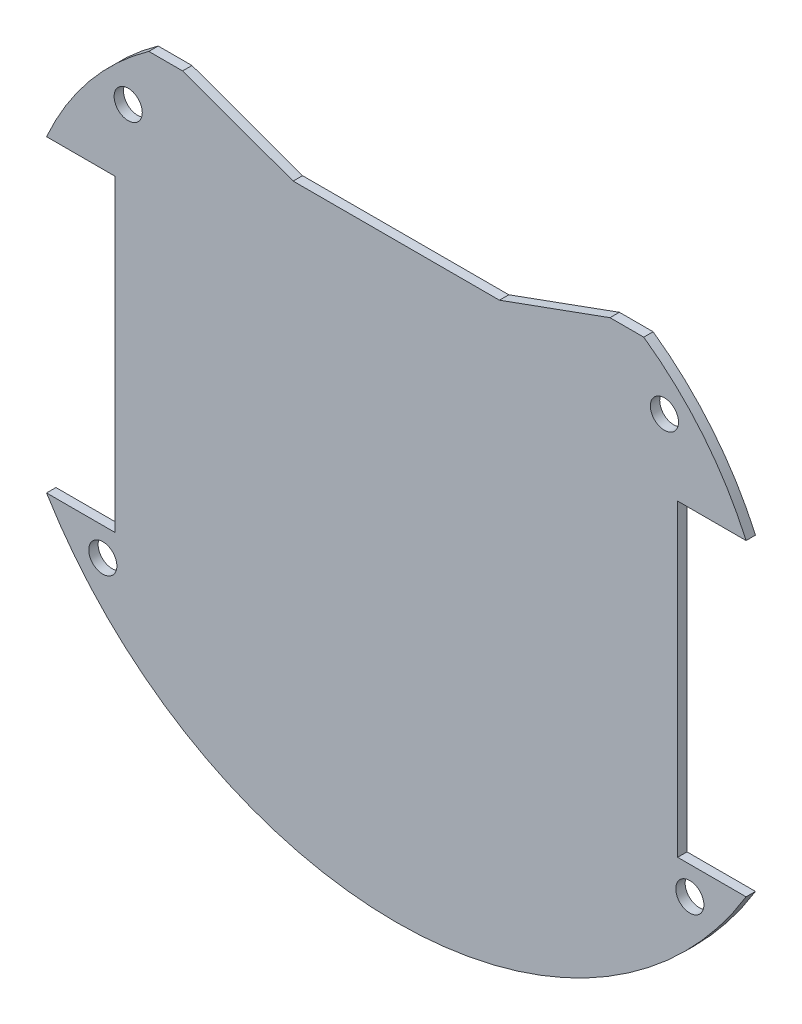
from build123d import *

# Parameters (mm, degrees)
BOSS_EXTRUDE1_DEPTH = 3
SKETCH2_R           = 1.5
CUT_EXTRUDE3_DEPTH  = 3
CUT_EXTRUDE4_START  = -10
CUT_EXTRUDE4_DEPTH  = 10
BOSS_EXTRUDE2_START = -3
BOSS_EXTRUDE2_DEPTH = 3
SKETCH5_W           = 0.56
SKETCH5_H           = 32.898596714
CUT_EXTRUDE5_DEPTH  = 3
SKETCH6_W           = 0.2
SKETCH6_H           = 32.898596714
CUT_EXTRUDE6_DEPTH  = 3
SKETCH7_R           = 2
CUT_EXTRUDE8_DEPTH  = 3
BOSS_EXTRUDE3_START = -3
BOSS_EXTRUDE3_DEPTH = 3
CUT_EXTRUDE9_START  = -3
CUT_EXTRUDE9_DEPTH  = 3
BOSS_EXTRUDE5_START = -3
BOSS_EXTRUDE5_DEPTH = 3
SKETCH11_R          = 1.5
CUT_EXTRUDE10_DEPTH = 3
CUT_EXTRUDE11_DEPTH = 3
SKETCH13_W          = 7
SKETCH13_H          = 1.5
CUT_EXTRUDE12_DEPTH = 3
SKETCH14_R          = 2
SKETCH14_R_2        = 1.5
SKETCH14_W          = 7
SKETCH14_H          = 1.5
BOSS_EXTRUDE6_DEPTH = 3
CUT_EXTRUDE13_START = -2
CUT_EXTRUDE13_DEPTH = 2
SKETCH16_R          = 1.5
CUT_EXTRUDE14_DEPTH = 2


with BuildPart() as part:
    # Sketch1 → Boss-Extrude1 (new body)
    with BuildSketch(Plane.XY):
        with BuildLine():
            Line((-11, 25.5), (-22.790038711, 29.780264196))
            ThreePointArc((-22.790038711, 29.780264196), (0, -37.5), (22.790038711, 29.780264196))
            Line((22.790038711, 29.780264196), (11, 25.5))
            Line((11, 25.5), (-11, 25.5))
        make_face()
    extrude(amount=BOSS_EXTRUDE1_DEPTH)

    # Sketch2 → Cut-Extrude3 (cut)
    with BuildSketch(Plane.XY.offset(3)):
        with Locations((-25.400000001, 10.496905453)):
            Circle(SKETCH2_R)
        with Locations((-25.399981845, -10.493094547)):
            Circle(SKETCH2_R)
        with Locations(Location((25.399981845, -10.493094547, 0), (0, 0, 180))):
            Circle(SKETCH2_R)
        with Locations(Location((25.400000001, 10.496905453, 0), (0, 0, 180))):
            Circle(SKETCH2_R)
    extrude(amount=-CUT_EXTRUDE3_DEPTH, mode=Mode.SUBTRACT)

    # Sketch3 → Cut-Extrude4 (cut)
    with BuildSketch(Plane.XY.offset(3).offset(CUT_EXTRUDE4_START)):
        with BuildLine():
            Line((-30.76, 21.449298357), (-30.76, -21.449298357))
            ThreePointArc((-30.76, -21.449298357), (-37.5, 0), (-30.76, 21.449298357))
        make_face()
        with BuildLine():
            Line((30.76, 21.449298357), (30.76, -21.449298357))
            ThreePointArc((30.76, -21.449298357), (37.5, 0), (30.76, 21.449298357))
        make_face()
    extrude(amount=CUT_EXTRUDE4_DEPTH, mode=Mode.SUBTRACT)

    # Sketch4 → Boss-Extrude2 (add)
    with BuildSketch(Plane.XY.offset(3).offset(BOSS_EXTRUDE2_START)):
        with BuildLine():
            Line((-30.76, -21.449298357), (-30.76, -16.449298357))
            Line((-30.76, -16.449298357), (-33.699711921, -16.449298357))
            ThreePointArc((-33.699711921, -16.449298357), (-32.32667034, -19.006219634), (-30.76, -21.449298357))
        make_face()
        with BuildLine():
            Line((-33.699711921, 16.449298357), (-30.76, 16.449298357))
            Line((-30.76, 16.449298357), (-30.76, 21.449298357))
            ThreePointArc((-30.76, 21.449298357), (-32.32667034, 19.006219634), (-33.699711921, 16.449298357))
        make_face()
        with BuildLine():
            Line((30.76, 21.449298357), (30.76, 16.449298357))
            Line((30.76, 16.449298357), (33.699711921, 16.449298357))
            ThreePointArc((33.699711921, 16.449298357), (32.32667034, 19.006219634), (30.76, 21.449298357))
        make_face()
        with BuildLine():
            Line((30.76, -16.449298357), (30.76, -21.449298357))
            ThreePointArc((30.76, -21.449298357), (32.32667034, -19.006219634), (33.699711921, -16.449298357))
            Line((33.699711921, -16.449298357), (30.76, -16.449298357))
        make_face()
    extrude(amount=BOSS_EXTRUDE2_DEPTH)

    # Sketch5 → Cut-Extrude5 (cut)
    with BuildSketch(Plane.XY.offset(3)):
        with Locations((-30.48, 0)):
            Rectangle(SKETCH5_W, SKETCH5_H)
        with Locations((30.48, 0)):
            Rectangle(SKETCH5_W, SKETCH5_H)
    extrude(amount=-CUT_EXTRUDE5_DEPTH, mode=Mode.SUBTRACT)

    # Sketch6 → Cut-Extrude6 (cut)
    with BuildSketch(Plane.XY.offset(3)):
        with Locations((-30.1, 0)):
            Rectangle(SKETCH6_W, SKETCH6_H)
        with Locations((30.1, 0)):
            Rectangle(SKETCH6_W, SKETCH6_H)
    extrude(amount=-CUT_EXTRUDE6_DEPTH, mode=Mode.SUBTRACT)

    # Sketch7 → Cut-Extrude8 (cut)
    with BuildSketch(Plane.XY.offset(3)):
        with Locations((-19.15, -21.55)):
            Circle(SKETCH7_R)
        with Locations(Location((19.15, -21.55, 0), (0, 0, 180))):
            Circle(SKETCH7_R)
    extrude(amount=-CUT_EXTRUDE8_DEPTH, mode=Mode.SUBTRACT)

    # Sketch8 → Boss-Extrude3 (add)
    with BuildSketch(Plane.XY.offset(3).offset(BOSS_EXTRUDE3_START)):
        with BuildLine():
            Line((-33.699711921, 16.449298357), (-37.299711921, 16.449298357))
            ThreePointArc((-37.299711921, 16.449298357), (-32.744884003, 23.851322108), (-26.390038711, 29.780264196))
            Line((-26.390038711, 29.780264196), (-22.790038711, 29.780264196))
            ThreePointArc((-22.790038711, 29.780264196), (-29.020710607, 23.749702226), (-33.699711921, 16.449298357))
        make_face()
        with BuildLine():
            Line((33.699711921, 16.449298357), (37.299711921, 16.449298357))
            ThreePointArc((37.299711921, 16.449298357), (32.744884003, 23.851322108), (26.390038711, 29.780264196))
            Line((26.390038711, 29.780264196), (22.790038711, 29.780264196))
            ThreePointArc((22.790038711, 29.780264196), (29.020710607, 23.749702226), (33.699711921, 16.449298357))
        make_face()
    extrude(amount=BOSS_EXTRUDE3_DEPTH)

    # Sketch9 → Cut-Extrude9 (cut)
    with BuildSketch(Plane.XY.offset(3).offset(CUT_EXTRUDE9_START)):
        with BuildLine():
            Line((4.733920151, -37.2), (-4.733920151, -37.2))
            ThreePointArc((-4.733920151, -37.2), (0, -37.5), (4.733920151, -37.2))
        make_face()
    extrude(amount=CUT_EXTRUDE9_DEPTH, mode=Mode.SUBTRACT)

    # Sketch10 → Boss-Extrude5 (add)
    with BuildSketch(Plane.XY.offset(3).offset(BOSS_EXTRUDE5_START)):
        with BuildLine():
            ThreePointArc((-4.733920151, -37.2), (-21.838816892, -30.484685938), (-33.699711921, -16.449298357))
            Line((-33.699711921, -16.449298357), (-37.299711921, -16.449298357))
            ThreePointArc((-37.299711921, -16.449298357), (-23.43831182, -30.624902723), (-4.733920151, -37.2))
        make_face()
        with BuildLine():
            ThreePointArc((33.699711921, -16.449298357), (21.838816892, -30.484685938), (4.733920151, -37.2))
            ThreePointArc((4.733920151, -37.2), (23.43831182, -30.624902723), (37.299711921, -16.449298357))
            Line((37.299711921, -16.449298357), (33.699711921, -16.449298357))
        make_face()
        with BuildLine():
            Line((4.733920151, -37.2), (-4.733920151, -37.2))
            ThreePointArc((-4.733920151, -37.2), (0, -37.457659609), (4.733920151, -37.2))
        make_face()
    extrude(amount=BOSS_EXTRUDE5_DEPTH)

    # Sketch11 → Cut-Extrude10 (cut)
    with BuildSketch(Plane.XY.offset(3)):
        with Locations((-28.590038711, 23.780264196)):
            Circle(SKETCH11_R)
        with Locations(Location((28.590038711, 23.780264196, 0), (0, 0, 180))):
            Circle(SKETCH11_R)
    extrude(amount=-CUT_EXTRUDE10_DEPTH, mode=Mode.SUBTRACT)

    # Sketch12 → Cut-Extrude11 (cut)
    with BuildSketch(Plane.XY.offset(3)):
        Polygon((-22.005113558, -26.391105244), (-15.660959049, -29.349433076), (-16.294886442, -30.708894756), (-22.639040951, -27.750566924), align=None)
        Polygon((22.005113558, -26.391105244), (15.660959049, -29.349433076), (16.294886442, -30.708894756), (22.639040951, -27.750566924), align=None)
    extrude(amount=-CUT_EXTRUDE11_DEPTH, mode=Mode.SUBTRACT)

    # Sketch13 → Cut-Extrude12 (cut)
    with BuildSketch(Plane.XY.offset(3)):
        with Locations((-17.400000001, 9.496905453)):
            Rectangle(SKETCH13_W, SKETCH13_H)
        with Locations((17.400000001, 9.496905453)):
            Rectangle(SKETCH13_W, SKETCH13_H)
    extrude(amount=-CUT_EXTRUDE12_DEPTH, mode=Mode.SUBTRACT)

    # Sketch14 → Boss-Extrude6 (add)
    with BuildSketch(Plane.XY.offset(3)):
        with Locations((-19.15, -21.55)):
            Circle(SKETCH14_R)
        with Locations((19.15, -21.55)):
            Circle(SKETCH14_R)
        with Locations((-25.399981845, -10.493094547)):
            Circle(SKETCH14_R_2)
        with Locations((-25.400000001, 10.496905453)):
            Circle(SKETCH14_R_2)
        with Locations((25.400000001, 10.496905453)):
            Circle(SKETCH14_R_2)
        with Locations((25.399981845, -10.493094547)):
            Circle(SKETCH14_R_2)
        Polygon((-22.005113558, -26.391105244), (-22.639040951, -27.750566924), (-16.294886442, -30.708894756), (-15.660959049, -29.349433076), align=None)
        with Locations((-17.400000001, 9.496905453)):
            Rectangle(SKETCH14_W, SKETCH14_H)
        with Locations((17.400000001, 9.496905453)):
            Rectangle(SKETCH14_W, SKETCH14_H)
        Polygon((16.294886442, -30.708894756), (15.660959049, -29.349433076), (22.005113558, -26.391105244), (22.639040951, -27.750566924), align=None)
    extrude(amount=-BOSS_EXTRUDE6_DEPTH)

    # Sketch15 → Cut-Extrude13 (cut)
    with BuildSketch(Plane.XY.offset(3).offset(CUT_EXTRUDE13_START)):
        with BuildLine():
            Line((-37.299711921, 16.449298357), (-30, 16.449298357))
            Line((-30, 16.449298357), (-30, -16.449298357))
            Line((-30, -16.449298357), (-37.299711921, -16.449298357))
            ThreePointArc((-37.299711921, -16.449298357), (0, -37.457659609), (37.299711921, -16.449298357))
            Line((37.299711921, -16.449298357), (30, -16.449298357))
            Line((30, -16.449298357), (30, 16.449298357))
            Line((30, 16.449298357), (37.299711921, 16.449298357))
            ThreePointArc((37.299711921, 16.449298357), (32.744884003, 23.851322108), (26.390038711, 29.780264196))
            Line((26.390038711, 29.780264196), (22.790038711, 29.780264196))
            Line((22.790038711, 29.780264196), (11, 25.5))
            Line((11, 25.5), (-11, 25.5))
            Line((-11, 25.5), (-22.790038711, 29.780264196))
            Line((-22.790038711, 29.780264196), (-26.390038711, 29.780264196))
            ThreePointArc((-26.390038711, 29.780264196), (-32.744884003, 23.851322108), (-37.299711921, 16.449298357))
        make_face()
    extrude(amount=CUT_EXTRUDE13_DEPTH, mode=Mode.SUBTRACT)

    # Sketch16 → Cut-Extrude14 (cut)
    with BuildSketch(Plane.XY.offset(1)):
        with Locations((-31.299711921, -19.449298357)):
            Circle(SKETCH16_R)
        with Locations((31.299711921, -19.449298357)):
            Circle(SKETCH16_R)
    extrude(amount=-CUT_EXTRUDE14_DEPTH, mode=Mode.SUBTRACT)


solid = part.part
